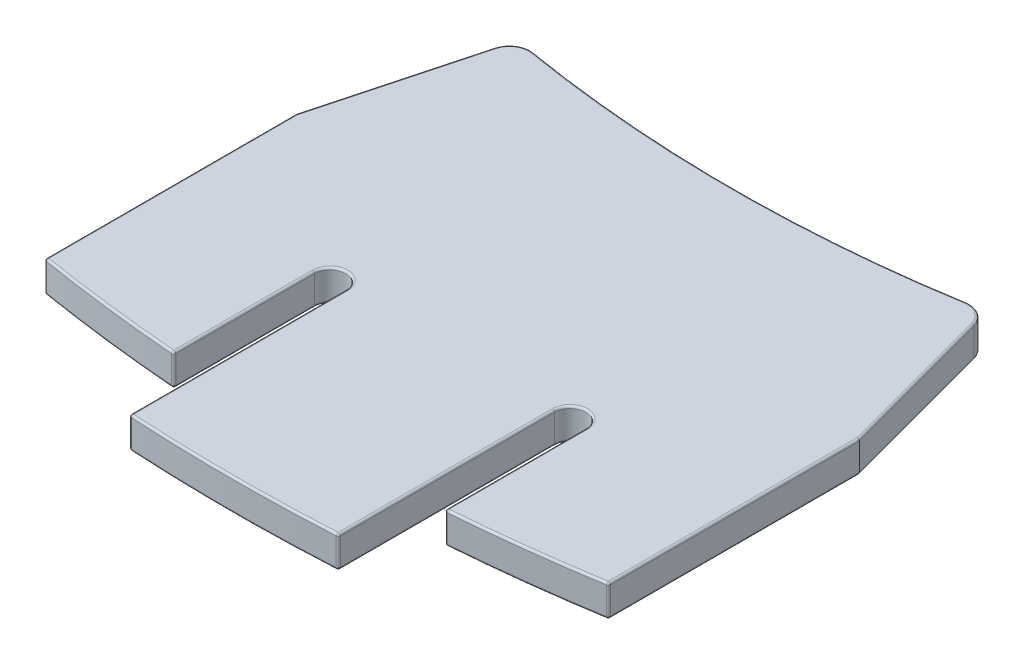
from build123d import *

# Parameters (mm, degrees)
BOSS_EXTRUDE1_DEPTH = 3
FILLET1_R           = 0.2


with BuildPart() as part:
    # Sketch1 → Boss-Extrude1 (new body)
    with BuildSketch(Plane(origin=(0, 0, 0), x_dir=(1, 0, 0), z_dir=(0, 1, 0))):
        with BuildLine():
            Line((-10, 29), (-10, 8.285947903))
            ThreePointArc((-10, 8.285947903), (0, 8), (10, 8.285947903))
            Line((10, 8.285947903), (10, 29))
            ThreePointArc((10, 29), (11.5, 30.5), (13, 29))
            Line((13, 29), (13, 15.503731385))
            ThreePointArc((13, 15.503731385), (20.017634438, 16.196839624), (27, 17.183836735))
            Line((27, 17.183836735), (27, 41.21477169))
            Line((27, 41.21477169), (22.972622015, 56.245150951))
            ThreePointArc((22.972622015, 56.245150951), (22.124373546, 57.408525693), (20.714556868, 57.700729716))
            ThreePointArc((20.714556868, 57.700729716), (0, 56), (-20.714556868, 57.700729716))
            ThreePointArc((-20.714556868, 57.700729716), (-22.124373546, 57.408525693), (-22.972622015, 56.245150951))
            Line((-22.972622015, 56.245150951), (-27, 41.21477169))
            Line((-27, 41.21477169), (-27, 17.183836735))
            ThreePointArc((-27, 17.183836735), (-20.017634438, 16.196839624), (-13, 15.503731385))
            Line((-13, 15.503731385), (-13, 28.994346903))
            ThreePointArc((-13, 28.994346903), (-11.50283188, 30.500002663), (-10, 29))
        make_face()
    extrude(amount=BOSS_EXTRUDE1_DEPTH)

    # Fillet1
    fillet1_edges = [part.edges().sort_by_distance(p)[0] for p in [
        (0, 3, -8),
        (10, 3, -18.642973952),
        (-13, 0, -22.249039144),
        (-20.017634438, 0, -16.196839624),
        (-27, 0, -29.199304212),
        (-24.986311008, 0, -48.729961321),
        (-22.124373546, 0, -57.408525693),
        (11.5, 3, -30.5),
        (0, 0, -56),
        (22.124373546, 0, -57.408525693),
        (24.986311008, 0, -48.729961321),
        (27, 0, -29.199304212),
        (20.017634438, 0, -16.196839624),
        (13, 0, -22.251865692),
        (11.5, 0, -30.5),
        (10, 0, -18.642973952),
        (13, 3, -22.251865692),
        (0, 0, -8),
        (-10, 0, -18.642973952),
        (-11.50283188, 0, -30.500002663),
        (20.017634438, 3, -16.196839624),
        (27, 3, -29.199304212),
        (-13, 1.5, -15.503731385),
        (-27, 1.5, -17.183836735),
        (27, 1.5, -17.183836735),
        (13, 1.5, -15.503731385),
        (10, 1.5, -8.285947903),
        (-10, 1.5, -8.285947903),
        (24.986311008, 3, -48.729961321),
        (22.124373546, 3, -57.408525693),
        (0, 3, -56),
        (-22.124373546, 3, -57.408525693),
        (-11.50283188, 3, -30.500002663),
        (-24.986311008, 3, -48.729961321),
        (-27, 3, -29.199304212),
        (-20.017634438, 3, -16.196839624),
        (-13, 3, -22.249039144),
        (-10, 3, -18.642973952),
    ]]
    fillet(fillet1_edges, radius=FILLET1_R)


solid = part.part
